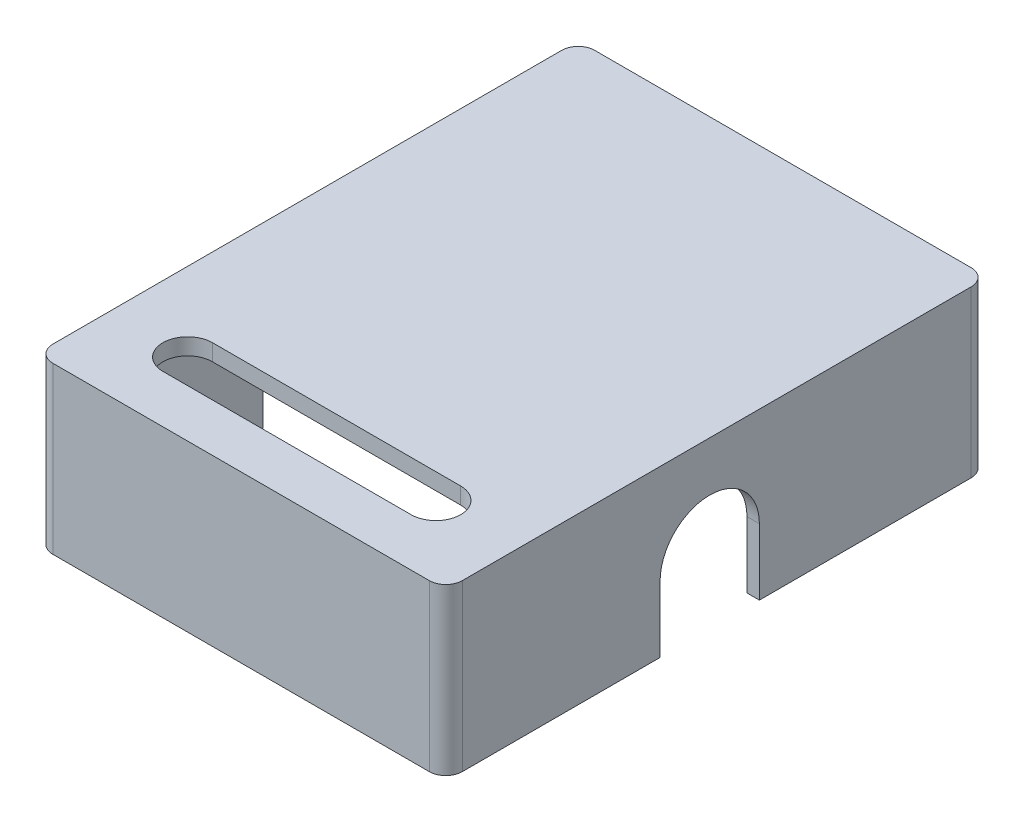
from build123d import *

# Parameters (mm, degrees)
BOSS_EXTRUDE33_DEPTH = 5
BOSS_EXTRUDE34_START = 5
BOSS_EXTRUDE34_DEPTH = 1
BOSS_EXTRUDE35_START = -4
BOSS_EXTRUDE35_DEPTH = 4
CUT_EXTRUDE2_DEPTH   = 35.891044696
CUT_EXTRUDE3_DEPTH   = 30.173146899
SKETCH22_W           = 13.5
SKETCH22_H           = 2
BOSS_EXTRUDE37_DEPTH = 1.75
SKETCH23_W           = 3
SKETCH23_H           = 3
BOSS_EXTRUDE38_DEPTH = 1.75
CUT_EXTRUDE4_DEPTH   = 3
CUT_EXTRUDE5_DEPTH   = 17.5


with BuildPart() as part:
    # lid → Boss-Extrude33 (new body)
    with BuildSketch(Plane(origin=(0, 0, 0), x_dir=(1, 0, 0), z_dir=(0, 1, 0))):
        with BuildLine():
            Line((12.5, 23.85), (-10.25, 23.85))
            ThreePointArc((-10.25, 23.85), (-10.957106781, 23.557106781), (-11.25, 22.85))
            Line((-11.25, 22.85), (-11.25, -7.9))
            ThreePointArc((-11.25, -7.9), (-10.957106781, -8.607106781), (-10.25, -8.9))
            Line((-10.25, -8.9), (12.5, -8.9))
            ThreePointArc((12.5, -8.9), (13.207106781, -8.607106781), (13.5, -7.9))
            Line((13.5, -7.9), (13.5, 22.85))
            ThreePointArc((13.5, 22.85), (13.207106781, 23.557106781), (12.5, 23.85))
        make_face()
        with BuildLine():
            Line((-10.5, -7.65), (-10.5, 22.6))
            ThreePointArc((-10.5, 22.6), (-10.353553391, 22.953553391), (-10, 23.1))
            Line((-10, 23.1), (12.25, 23.1))
            ThreePointArc((12.25, 23.1), (12.603553391, 22.953553391), (12.75, 22.6))
            Line((12.75, 22.6), (12.75, -7.65))
            ThreePointArc((12.75, -7.65), (12.603553391, -8.003553391), (12.25, -8.15))
            Line((12.25, -8.15), (-10, -8.15))
            ThreePointArc((-10, -8.15), (-10.353553391, -8.003553391), (-10.5, -7.65))
        make_face(mode=Mode.SUBTRACT)
    extrude(amount=BOSS_EXTRUDE33_DEPTH)

    # lid<5> → Boss-Extrude34 (add)
    with BuildSketch(Plane(origin=(0, 0, 0), x_dir=(1, 0, 0), z_dir=(0, 1, 0)).offset(BOSS_EXTRUDE34_START)):
        with BuildLine():
            Line((12.5, 23.85), (-10.25, 23.85))
            ThreePointArc((-10.25, 23.85), (-10.957106781, 23.557106781), (-11.25, 22.85))
            Line((-11.25, 22.85), (-11.25, -7.9))
            ThreePointArc((-11.25, -7.9), (-10.957106781, -8.607106781), (-10.25, -8.9))
            Line((-10.25, -8.9), (12.5, -8.9))
            ThreePointArc((12.5, -8.9), (13.207106781, -8.607106781), (13.5, -7.9))
            Line((13.5, -7.9), (13.5, 22.85))
            ThreePointArc((13.5, 22.85), (13.207106781, 23.557106781), (12.5, 23.85))
        make_face()
    extrude(amount=BOSS_EXTRUDE34_DEPTH)

    # lid<7> → Boss-Extrude35 (add)
    with BuildSketch(Plane(origin=(0, 0, 0), x_dir=(1, 0, 0), z_dir=(0, 1, 0)).offset(BOSS_EXTRUDE35_START)):
        with BuildLine():
            Line((-10.25, 23.85), (12.5, 23.85))
            ThreePointArc((12.5, 23.85), (13.207106781, 23.557106781), (13.5, 22.85))
            Line((13.5, 22.85), (13.5, -7.9))
            ThreePointArc((13.5, -7.9), (13.207106781, -8.607106781), (12.5, -8.9))
            Line((12.5, -8.9), (-10.25, -8.9))
            ThreePointArc((-10.25, -8.9), (-10.957106781, -8.607106781), (-11.25, -7.9))
            Line((-11.25, -7.9), (-11.25, 22.85))
            ThreePointArc((-11.25, 22.85), (-10.957106781, 23.557106781), (-10.25, 23.85))
        make_face()
        with BuildLine():
            Line((-10.5, 22.6), (-10.5, -7.65))
            ThreePointArc((-10.5, -7.65), (-10.353553391, -8.003553391), (-10, -8.15))
            Line((-10, -8.15), (12.25, -8.15))
            ThreePointArc((12.25, -8.15), (12.603553391, -8.003553391), (12.75, -7.65))
            Line((12.75, -7.65), (12.75, 22.6))
            ThreePointArc((12.75, 22.6), (12.603553391, 22.953553391), (12.25, 23.1))
            Line((12.25, 23.1), (-10, 23.1))
            ThreePointArc((-10, 23.1), (-10.353553391, 22.953553391), (-10.5, 22.6))
        make_face(mode=Mode.SUBTRACT)
    extrude(amount=BOSS_EXTRUDE35_DEPTH)

    # Sketch21 → Cut-Extrude2 (cut, through all)
    with BuildSketch(Plane(origin=(13.5, 0, 0), x_dir=(0, 0, -1), z_dir=(1, 0, 0))):
        with BuildLine():
            Line((4.05, 0), (4.05, -4))
            Line((4.05, -4), (10.05, -4))
            Line((10.05, -4), (10.05, 0))
            ThreePointArc((10.05, 0), (7.05, 3), (4.05, 0))
        make_face()
    extrude(amount=-CUT_EXTRUDE2_DEPTH, mode=Mode.SUBTRACT)

    # Sketch20 → Cut-Extrude3 (cut, through all)
    with BuildSketch(Plane(origin=(0, 6, 0), x_dir=(1, 0, 0), z_dir=(0, 1, 0))):
        with BuildLine():
            Line((-6.5, -3), (8.5, -3))
            ThreePointArc((8.5, -3), (10, -4.5), (8.5, -6))
            Line((8.5, -6), (-6.5, -6))
            ThreePointArc((-6.5, -6), (-8, -4.5), (-6.5, -3))
        make_face()
    extrude(amount=-CUT_EXTRUDE3_DEPTH, mode=Mode.SUBTRACT)

    # Sketch22 → Boss-Extrude37 (add)
    with BuildSketch(Plane(origin=(0, 0, 8.15), x_dir=(-1, 0, 0), z_dir=(0, 0, -1))):
        with Locations((-0.75, -3)):
            Rectangle(SKETCH22_W, SKETCH22_H)
    extrude(amount=BOSS_EXTRUDE37_DEPTH)

    # Sketch23 → Boss-Extrude38 (add)
    with BuildSketch(Plane.XY.offset(-23.1)):
        with Locations((-7.5, -2.5)):
            Rectangle(SKETCH23_W, SKETCH23_H)
        with Locations((9.75, -2.5)):
            Rectangle(SKETCH23_W, SKETCH23_H)
    extrude(amount=BOSS_EXTRUDE38_DEPTH)

    # Sketch24 → Cut-Extrude4 (cut)
    with BuildSketch(Plane.ZY.offset(-8.25)):
        Polygon((-23.1, -4), (-21.35, -1), (-21.35, -4), align=None)
    extrude(amount=-CUT_EXTRUDE4_DEPTH, mode=Mode.SUBTRACT)

    # Sketch24<2> → Cut-Extrude5 (cut)
    with BuildSketch(Plane.ZY.offset(-8.25)):
        Polygon((-23.1, -4), (-21.35, -1), (-21.35, -4), align=None)
    extrude(amount=CUT_EXTRUDE5_DEPTH, mode=Mode.SUBTRACT)


solid = part.part
